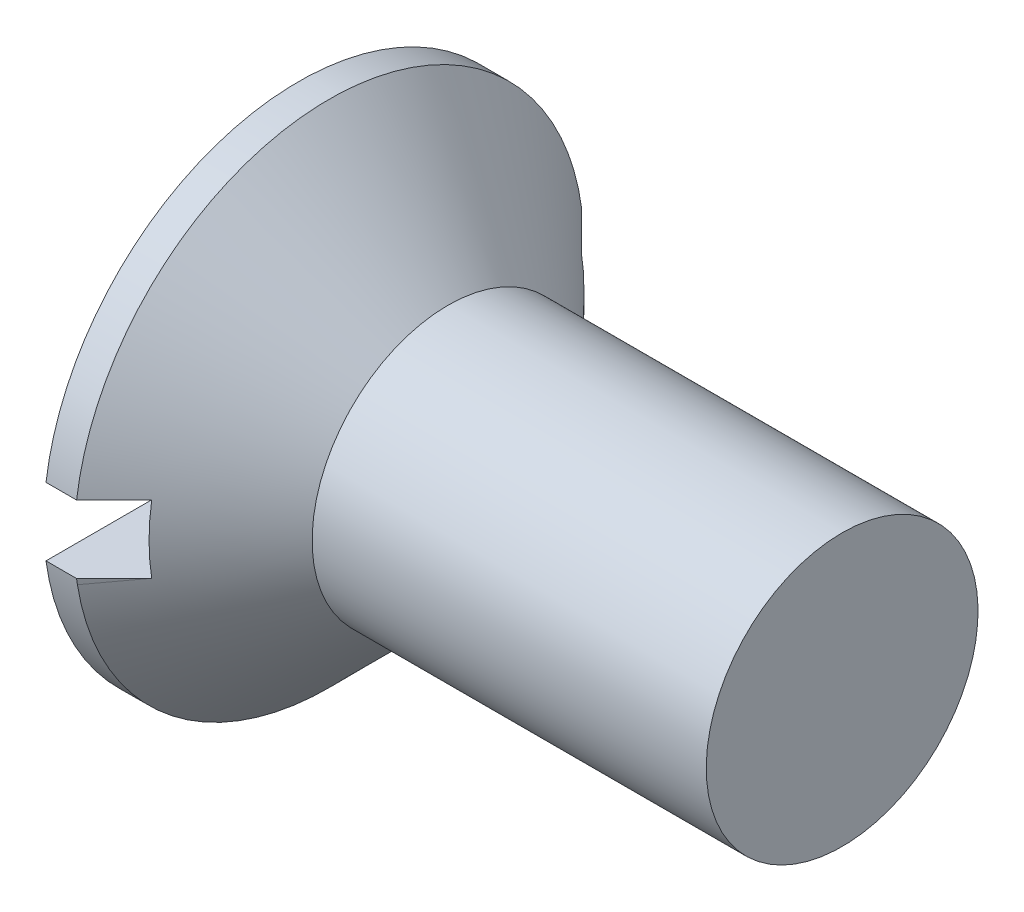
from build123d import *

# Parameters (mm, degrees)
SKETCH2_W          = 7.5
SKETCH2_H          = 1
CUT_EXTRUDE1_DEPTH = 1


with BuildPart() as part:
    # Sketch1 → Revolve1 (revolve)
    with BuildSketch(Plane.XY):
        Polygon((0, 0), (0, 3.75), (0.45, 3.75), (2.2, 2), (8, 2), (8, 0), align=None)
    revolve(axis=Axis((8, 0, 0), (-1, 0, 0)))

    # Sketch2 → Cut-Extrude1 (cut)
    with BuildSketch(Plane.ZY):
        Rectangle(SKETCH2_W, SKETCH2_H)
    extrude(amount=-CUT_EXTRUDE1_DEPTH, mode=Mode.SUBTRACT)


solid = part.part
